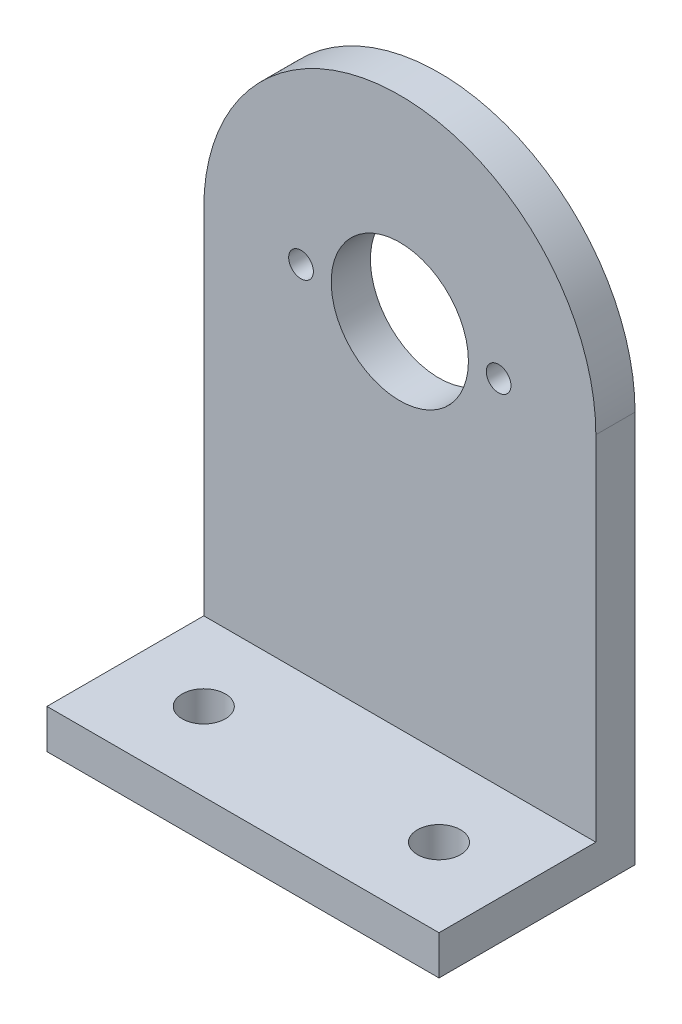
from build123d import *

# Parameters (mm, degrees)
BOSS_EXTRUDE1_DEPTH       = 3.175
SKETCH3_R                 = 5.55625
CUT_EXTRUDE1_DEPTH        = 36.639286609
SKETCH4_W                 = 31.75
SKETCH4_H                 = 3.175
BOSS_EXTRUDE2_DEPTH       = 12.7
SKETCH5_R                 = 1.75
CUT_EXTRUDE2_DEPTH        = 50.797929174
F_2_0MM_DOWEL_HOLE1_D     = 2
F_2_0MM_DOWEL_HOLE1_DEPTH = 12.7
F_2_0MM_DOWEL_HOLE1_TIP   = 0.600860619
CHAMFER1_SIZE             = 0.762


with BuildPart() as part:
    # Sketch1 → Boss-Extrude1 (new body)
    with BuildSketch(Plane.XY):
        with BuildLine():
            ThreePointArc((15.875, 0), (0, 15.875), (-15.875, 0))
            Line((-15.875, 0), (15.875, 0))
        make_face()
        with BuildLine():
            ThreePointArc((15.875, 0), (0, -15.875), (-15.875, 0))
            Line((-15.875, 0), (-15.875, -31.75))
            Line((-15.875, -31.75), (15.875, -31.75))
            Line((15.875, -31.75), (15.875, 0))
        make_face()
        with BuildLine():
            Line((15.875, 0), (-15.875, 0))
            ThreePointArc((-15.875, 0), (0, -15.875), (15.875, 0))
        make_face()
    extrude(amount=BOSS_EXTRUDE1_DEPTH)

    # Sketch3 → Cut-Extrude1 (cut, through all)
    with BuildSketch(Plane.XY.offset(3.175)):
        Circle(SKETCH3_R)
    extrude(amount=-CUT_EXTRUDE1_DEPTH, mode=Mode.SUBTRACT)

    # Sketch4 → Boss-Extrude2 (add)
    with BuildSketch(Plane.XY.offset(3.175)):
        with Locations((0, -30.1625)):
            Rectangle(SKETCH4_W, SKETCH4_H)
    extrude(amount=BOSS_EXTRUDE2_DEPTH)

    # Sketch5 → Cut-Extrude2 (cut, through all)
    with BuildSketch(Plane(origin=(0, -28.575, 0), x_dir=(1, 0, 0), z_dir=(0, 1, 0))):
        with Locations(Location((-9.525, -9.525, 0), (0, 0, 270))):
            Circle(SKETCH5_R)
        with Locations(Location((9.525, -9.525, 0), (0, 0, 90))):
            Circle(SKETCH5_R)
    extrude(amount=-CUT_EXTRUDE2_DEPTH, mode=Mode.SUBTRACT)

    # Ø2.0mm Dowel Hole1
    with Locations(Plane.XY.offset(3.175)):
        with Locations((-8.001, 0), (8.001, 0)):
            Hole(F_2_0MM_DOWEL_HOLE1_D / 2, depth=F_2_0MM_DOWEL_HOLE1_DEPTH)
            with Locations((0, 0, -(F_2_0MM_DOWEL_HOLE1_DEPTH + F_2_0MM_DOWEL_HOLE1_TIP / 2))):  # 118° drill point
                Cone(0, F_2_0MM_DOWEL_HOLE1_D / 2, F_2_0MM_DOWEL_HOLE1_TIP, mode=Mode.SUBTRACT)

    # Chamfer1
    chamfer1_edges = [part.edges().sort_by_distance(p)[0] for p in [
        (9.001, 0, 0),
        (-7.001, 0, 0),
    ]]
    chamfer(chamfer1_edges, length=CHAMFER1_SIZE)


solid = part.part
